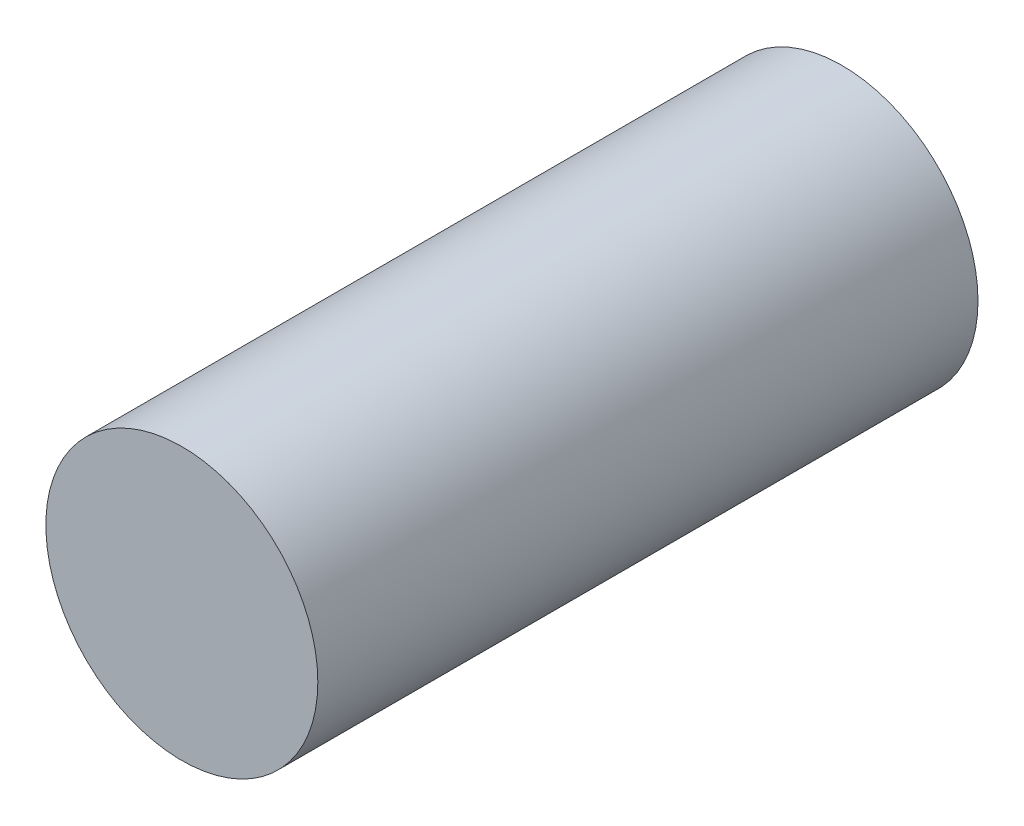
from build123d import *

# Parameters (mm, degrees)
SKETCH1_R           = 2.06
BOSS_EXTRUDE1_DEPTH = 10


with BuildPart() as part:
    # Sketch1 → Boss-Extrude1 (new body)
    with BuildSketch(Plane.XY):
        Circle(SKETCH1_R)
    extrude(amount=BOSS_EXTRUDE1_DEPTH)


solid = part.part
